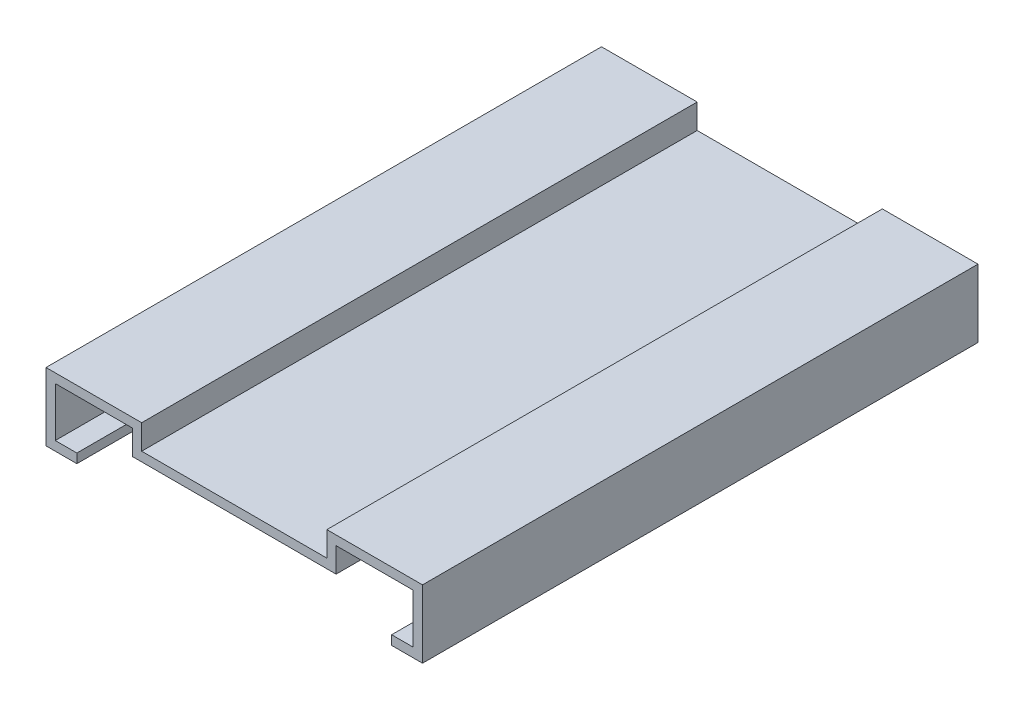
from build123d import *

# Parameters (mm, degrees)
BOSS_EXTRUDE1_DEPTH      = 90
BOSS_EXTRUDE1_DEPTH_BACK = 90
SKETCH1_W                = 122
SKETCH1_H                = 22
SKETCH2_W                = 25
SKETCH2_H                = 16
CUT_EXTRUDE1_DEPTH       = 191.373317458
SKETCH3_W                = 60
SKETCH3_H                = 16
CUT_EXTRUDE2_DEPTH       = 191.373317458
SKETCH4_W                = 60.154663558
SKETCH4_H                = 22
CUT_EXTRUDE3_DEPTH       = 191.373317458
SKETCH5_W                = 20.922668221
SKETCH5_H                = 11
CUT_EXTRUDE4_DEPTH       = 191.373317458


with BuildPart() as part:
    # Sketch1 → Boss-Extrude1 (new, two sides: drawn at the far end of the back side and taken through both)
    with BuildSketch(Plane.XY.offset(-BOSS_EXTRUDE1_DEPTH_BACK)):
        Rectangle(SKETCH1_W, SKETCH1_H)
    extrude(amount=BOSS_EXTRUDE1_DEPTH + BOSS_EXTRUDE1_DEPTH_BACK)

    # Sketch2 → Cut-Extrude1 (cut, symmetric)
    with BuildSketch(Plane.XY.offset(90)):
        with Locations((45.5, 0)):
            Rectangle(SKETCH2_W, SKETCH2_H)
    cut_extrude1 = extrude(amount=CUT_EXTRUDE1_DEPTH, both=True, mode=Mode.SUBTRACT)

    # Mirror1: Cut-Extrude1 across plane
    add(cut_extrude1.mirror(Plane(origin=(0, 0, 0), x_dir=(0, 0, 1), z_dir=(1, 0, 0))), mode=Mode.SUBTRACT)

    # Sketch3 → Cut-Extrude2 (cut, through all)
    with BuildSketch(Plane.XY.offset(90)):
        with Locations((0, 11)):
            Rectangle(SKETCH3_W, SKETCH3_H)
    extrude(amount=-CUT_EXTRUDE2_DEPTH, mode=Mode.SUBTRACT)

    # Sketch4 → Cut-Extrude3 (cut, through all)
    with BuildSketch(Plane.XY.offset(90)):
        with Locations((0, -11)):
            Rectangle(SKETCH4_W, SKETCH4_H)
    extrude(amount=-CUT_EXTRUDE3_DEPTH, mode=Mode.SUBTRACT)

    # Sketch5 → Cut-Extrude4 (cut, through all)
    with BuildSketch(Plane.XY.offset(90)):
        with Locations((40.53866589, -5.5)):
            Rectangle(SKETCH5_W, SKETCH5_H)
    cut_extrude4 = extrude(amount=-CUT_EXTRUDE4_DEPTH, mode=Mode.SUBTRACT)

    # Mirror2: Cut-Extrude4 across plane
    add(cut_extrude4.mirror(Plane(origin=(0, 0, 0), x_dir=(0, 0, 1), z_dir=(1, 0, 0))), mode=Mode.SUBTRACT)


solid = part.part
